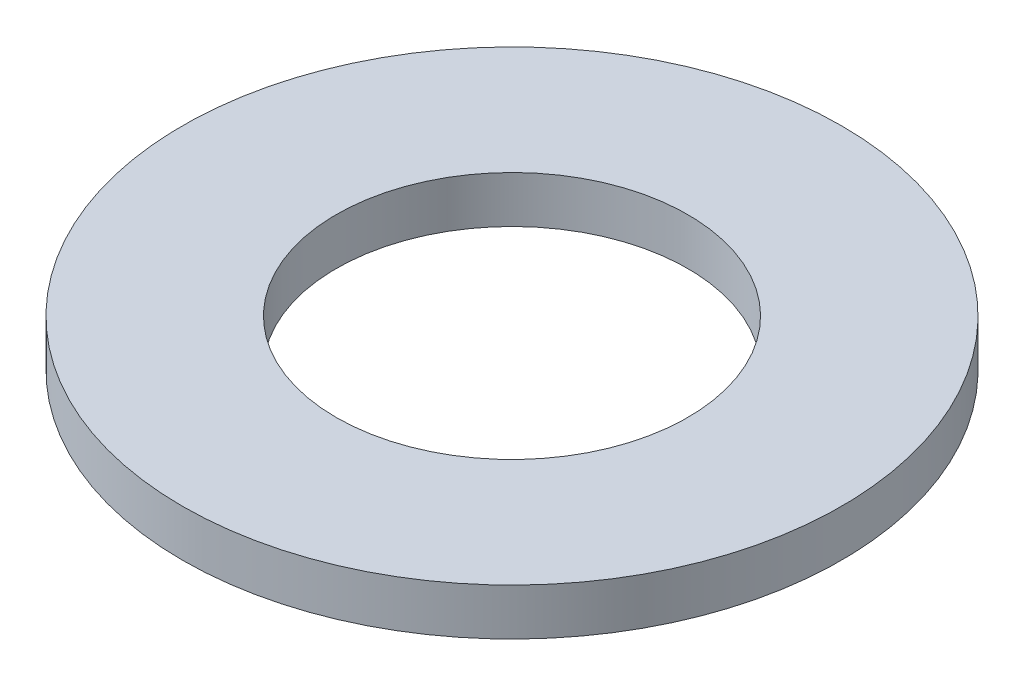
from build123d import *

# Parameters (mm, degrees)
SKETCH1_R           = 37.5
SKETCH1_R_2         = 20
BOSS_EXTRUDE1_DEPTH = 5.32


with BuildPart() as part:
    # Sketch1 → Boss-Extrude1 (new body)
    with BuildSketch(Plane(origin=(0, 0, 0), x_dir=(1, 0, 0), z_dir=(0, 1, 0))):
        with Locations(Location((0, 0, 0), (0, 0, 270))):
            Circle(SKETCH1_R)
        with Locations(Location((0, 0, 0), (0, 0, 270))):
            Circle(SKETCH1_R_2, mode=Mode.SUBTRACT)
    extrude(amount=BOSS_EXTRUDE1_DEPTH)


solid = part.part
